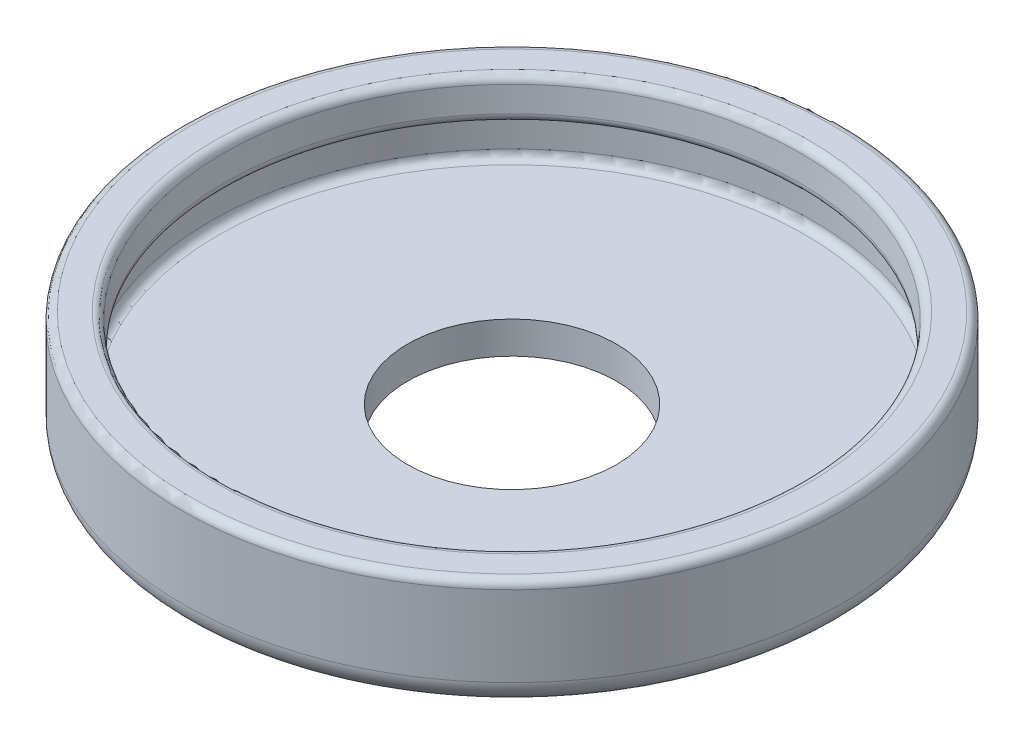
from build123d import *

# Parameters (mm, degrees)
FILLET1_R = 0.381
FILLET2_R = 0.127


with BuildPart() as part:
    # Sketch1 → Revolve1 (revolve)
    with BuildSketch(Plane.XY):
        Polygon((1.651, 0), (5.207, 0), (5.207, 1.778), (4.572, 1.778), (4.5212, 1.143), (4.7625, 1.143), (4.7625, 0.508), (1.651, 0.508), align=None)
    revolve(axis=Axis((0, -28.291583107, 0), (0, 1, 0)))

    # Fillet1
    fillet1_edges = [part.edges().sort_by_distance(p)[0] for p in [
        (-5.207, 0, 0),
    ]]
    fillet(fillet1_edges, radius=FILLET1_R)

    # Fillet2
    fillet2_edges = [part.edges().sort_by_distance(p)[0] for p in [
        (-4.7625, 0.508, 0),
        (-4.5212, 1.143, 0),
        (-4.572, 1.778, 0),
        (-5.207, 1.778, 0),
    ]]
    fillet(fillet2_edges, radius=FILLET2_R)


solid = part.part
